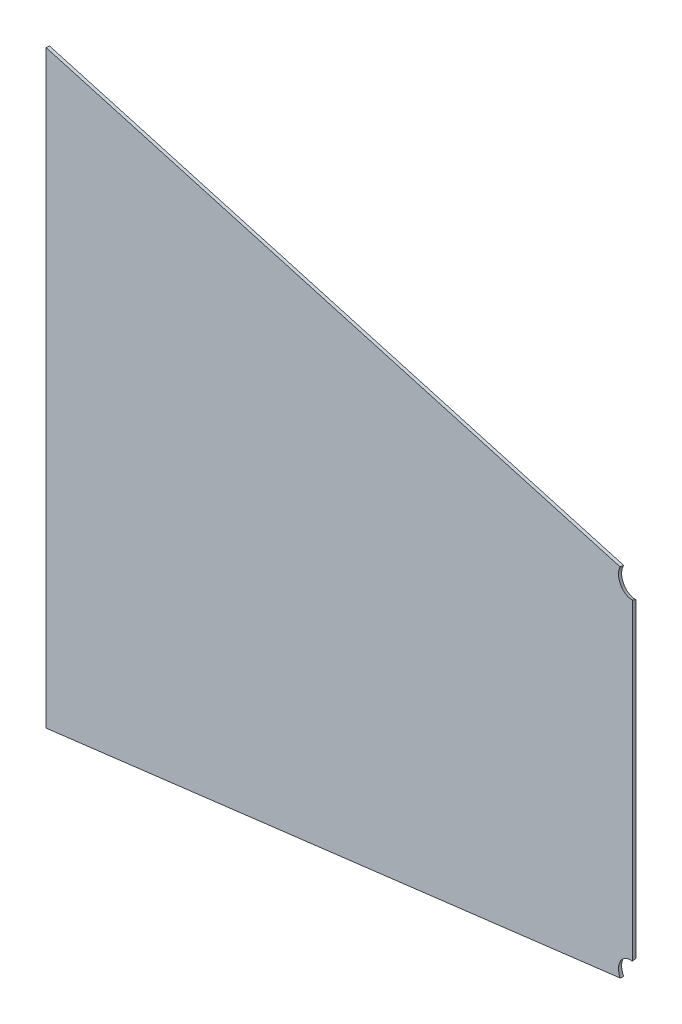
from build123d import *

# Parameters (mm, degrees)
BOSS_EXTRUDE1_DEPTH = 3.175
SKETCH2_R           = 14.2875
CUT_EXTRUDE1_DEPTH  = 837.34562622


with BuildPart() as part:
    # Sketch1 → Boss-Extrude1 (new body)
    with BuildSketch(Plane(origin=(1.950344864, 0, -26.264644174), x_dir=(-0.9972542674746705, 0, -0.07405353471346578), z_dir=(0.07405353471346578, 0, -0.9972542674746705))):
        Polygon((-183.644373355, -298.45), (-183.644373355, 298.45), (-826.760197391, 177.8), (-826.760197391, -177.8), align=None)
    extrude(amount=BOSS_EXTRUDE1_DEPTH)

    # Sketch2 → Cut-Extrude1 (cut, through all)
    with BuildSketch(Plane(origin=(825.5, 212.942802273, 150.983020837), x_dir=(1, 0, 0), z_dir=(0, 0.32191156150474026, 0.9467697431633416))):
        Circle(SKETCH2_R)
    cut_extrude1 = extrude(amount=-CUT_EXTRUDE1_DEPTH, mode=Mode.SUBTRACT)

    # Mirror1: Cut-Extrude1 across plane
    add(cut_extrude1.mirror(Plane.ZX), mode=Mode.SUBTRACT)


solid = part.part
